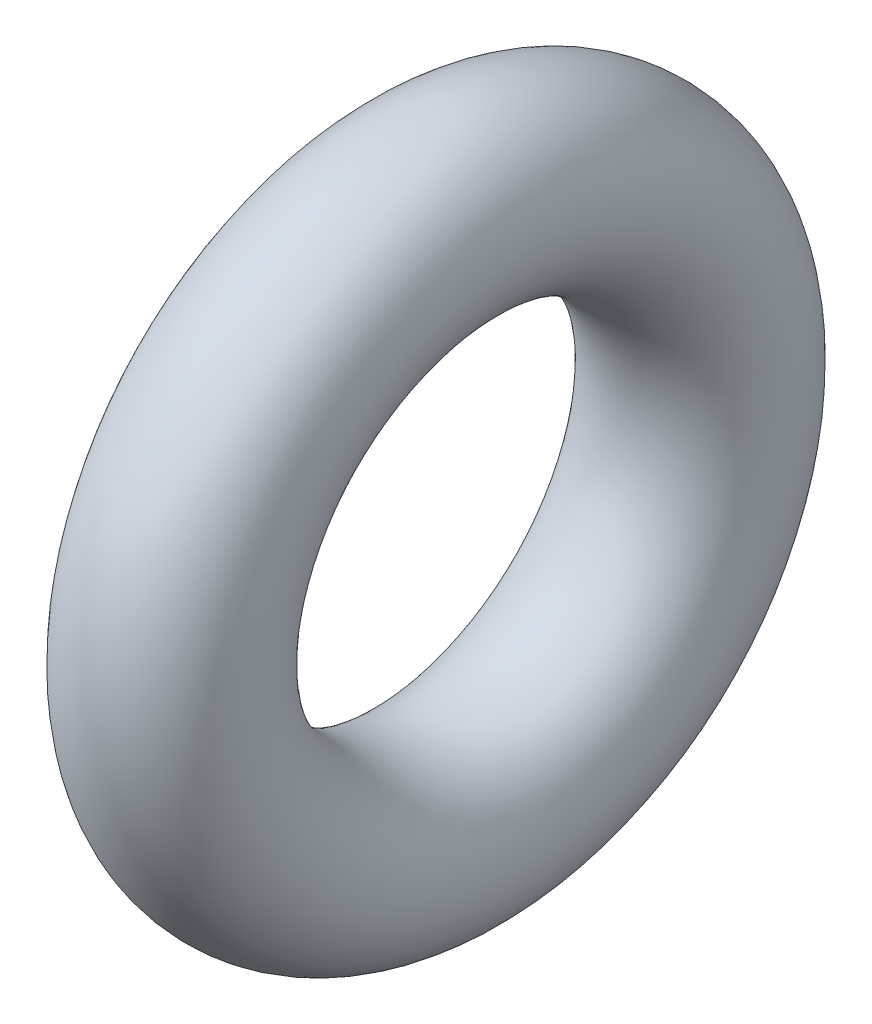
from build123d import *

# Parameters (mm, degrees)
SKETCH_1_R = 1.315


with BuildPart() as part:
    # 草图1 → 旋转1 (revolve)
    with BuildSketch(Plane.XY, mode=Mode.PRIVATE) as revolve_1_sk:
        with Locations((0, 3.93)):
            Circle(SKETCH_1_R)
    revolve(revolve_1_sk.sketch.rotate(Axis((0, 0, 0), (1, 0, 0)), 90), axis=Axis((0, 0, 0), (1, 0, 0)))


solid = part.part
